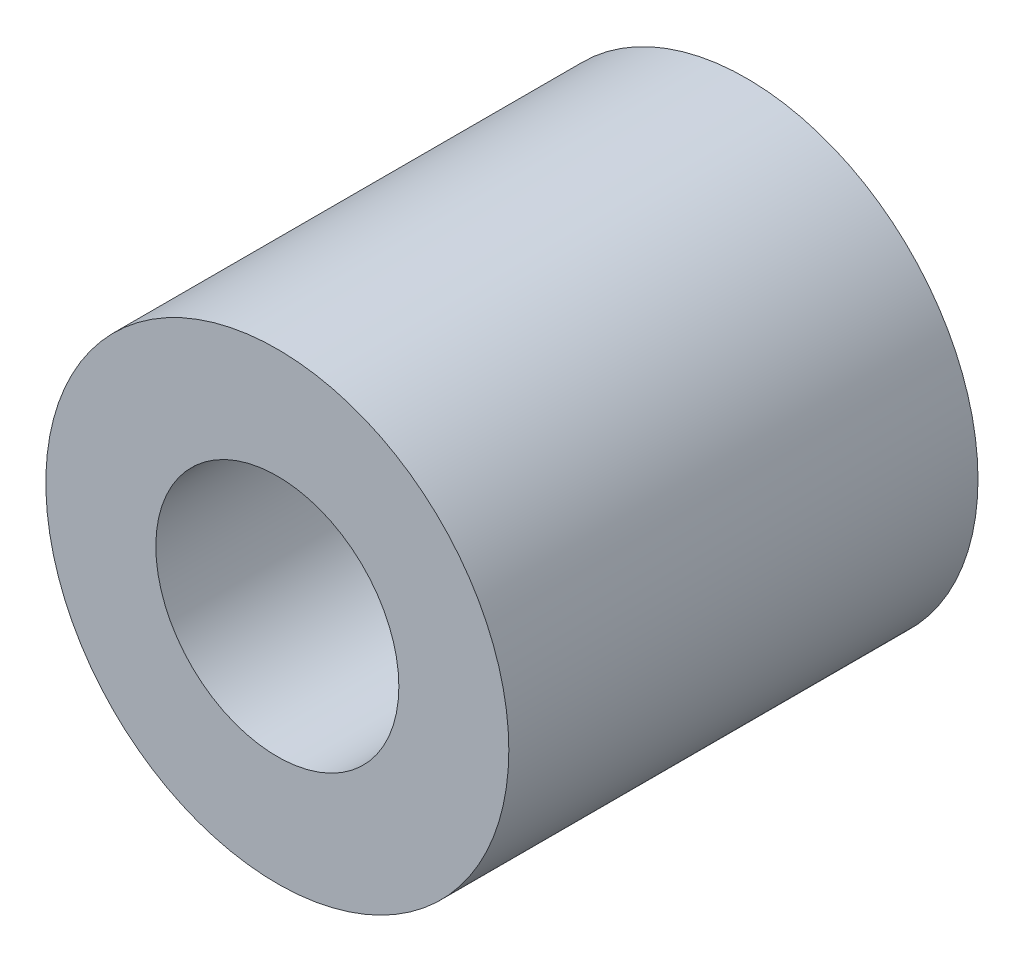
from build123d import *

# Parameters (mm, degrees)
SKETCH1_R           = 4.7625
BOSS_EXTRUDE1_DEPTH = 9
SKETCH2_R           = 4.7625
SKETCH2_R_2         = 2.5
BOSS_EXTRUDE2_DEPTH = 0.652


with BuildPart() as part:
    # Sketch1 → Boss-Extrude1 (new body)
    with BuildSketch(Plane.XY):
        Circle(SKETCH1_R)
        with BuildLine():
            Line((-1.5, 2), (1.5, 2))
            ThreePointArc((1.5, 2), (0, -2.5), (-1.5, 2))
        make_face(mode=Mode.SUBTRACT)
    extrude(amount=BOSS_EXTRUDE1_DEPTH)

    # Sketch2 → Boss-Extrude2 (add)
    with BuildSketch(Plane.XY.offset(9)):
        Circle(SKETCH2_R)
        with Locations(Location((0, 0, 0), (0, 0, 126.869897646))):
            Circle(SKETCH2_R_2, mode=Mode.SUBTRACT)
    extrude(amount=BOSS_EXTRUDE2_DEPTH)


solid = part.part
